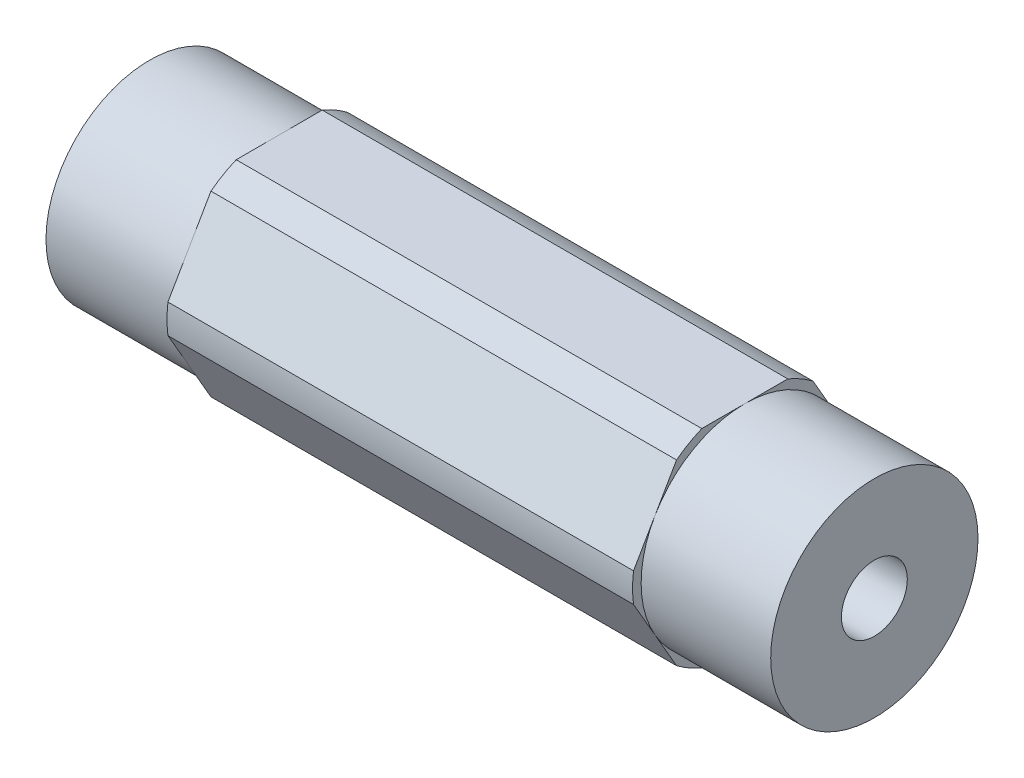
from build123d import *

# Parameters (mm, degrees)
SKETCH1_R                            = 2.0193
BOSS_EXTRUDE1_DEPTH                  = 22.1996
F_10_32_TAPPED_HOLE1_D               = 4.0386
F_10_32_TAPPED_HOLE1_DEPTH           = 16.34744
F_10_32_TAPPED_HOLE1_TIP             = 1.213317848
F_10_32_TAPPED_HOLE1_ON_FACE_2_D     = 4.0386
F_10_32_TAPPED_HOLE1_ON_FACE_2_DEPTH = 16.34744
F_10_32_TAPPED_HOLE1_ON_FACE_2_TIP   = 1.213317848
SKETCH3_R                            = 8.89
SKETCH3_R_2                          = 6.35
CUT_EXTRUDE_THIN1_DEPTH              = 7.9375


with BuildPart() as part:
    # Sketch1 → Boss-Extrude1 (new, symmetric)
    with BuildSketch(Plane(origin=(0, 0, 0), x_dir=(0, 0, -1), z_dir=(1, 0, 0))):
        with BuildLine():
            ThreePointArc((4.181770846, 5.456960429), (3.437499983, 5.953924622), (2.634980936, 6.35))
            Line((2.634980936, 6.35), (-2.634980936, 6.35))
            ThreePointArc((-2.634980936, 6.35), (-3.437499983, 5.953924622), (-4.181770846, 5.456960429))
            Line((-4.181770846, 5.456960429), (-6.816751782, 0.893039571))
            ThreePointArc((-6.816751782, 0.893039571), (-6.874999966, 0), (-6.816751782, -0.893039571))
            Line((-6.816751782, -0.893039571), (-4.181770846, -5.456960429))
            ThreePointArc((-4.181770846, -5.456960429), (-3.437499983, -5.953924622), (-2.634980936, -6.35))
            Line((-2.634980936, -6.35), (2.634980936, -6.35))
            ThreePointArc((2.634980936, -6.35), (3.437499983, -5.953924622), (4.181770846, -5.456960429))
            Line((4.181770846, -5.456960429), (6.816751782, -0.893039571))
            ThreePointArc((6.816751782, -0.893039571), (6.860422465, -0.447468582), (6.874999966, 0))
            ThreePointArc((6.874999966, 0), (6.860422465, 0.447468582), (6.816751782, 0.893039571))
            Line((6.816751782, 0.893039571), (4.181770846, 5.456960429))
        make_face()
        Circle(SKETCH1_R, mode=Mode.SUBTRACT)
    extrude(amount=BOSS_EXTRUDE1_DEPTH, both=True)

    # #10-32 Tapped Hole1
    with Locations(Plane(origin=(22.1996, 0, 0), x_dir=(0, 0, 1), z_dir=(1, 0, 0))):
        with Locations((0, 0)):
            Hole(F_10_32_TAPPED_HOLE1_D / 2, depth=F_10_32_TAPPED_HOLE1_DEPTH)
            with Locations((0, 0, -(F_10_32_TAPPED_HOLE1_DEPTH + F_10_32_TAPPED_HOLE1_TIP / 2))):  # 118° drill point
                Cone(0, F_10_32_TAPPED_HOLE1_D / 2, F_10_32_TAPPED_HOLE1_TIP, mode=Mode.SUBTRACT)

    # #10-32 Tapped Hole1 on face 2
    with Locations(Plane(origin=(-22.1996, 0, 0), x_dir=(0, 0, 1), z_dir=(1, 0, 0))):
        with Locations((0, 0)):
            Hole(F_10_32_TAPPED_HOLE1_ON_FACE_2_D / 2, depth=F_10_32_TAPPED_HOLE1_ON_FACE_2_DEPTH)
            with Locations((0, 0, -(F_10_32_TAPPED_HOLE1_ON_FACE_2_DEPTH + F_10_32_TAPPED_HOLE1_ON_FACE_2_TIP / 2))):  # 118° drill point
                Cone(0, F_10_32_TAPPED_HOLE1_ON_FACE_2_D / 2, F_10_32_TAPPED_HOLE1_ON_FACE_2_TIP, mode=Mode.SUBTRACT)

    # Sketch3 → Cut-Extrude-Thin1 (cut)
    with BuildSketch(Plane(origin=(22.1996, 0, 0), x_dir=(0, 0, -1), z_dir=(1, 0, 0))):
        Circle(SKETCH3_R)
        Circle(SKETCH3_R_2, mode=Mode.SUBTRACT)
    cut_extrude_thin1 = extrude(amount=-CUT_EXTRUDE_THIN1_DEPTH, mode=Mode.SUBTRACT)

    # Mirror1: Cut-Extrude-Thin1 across plane
    add(cut_extrude_thin1.mirror(Plane(origin=(0, 0, 0), x_dir=(0, 0, 1), z_dir=(1, 0, 0))), mode=Mode.SUBTRACT)


solid = part.part
